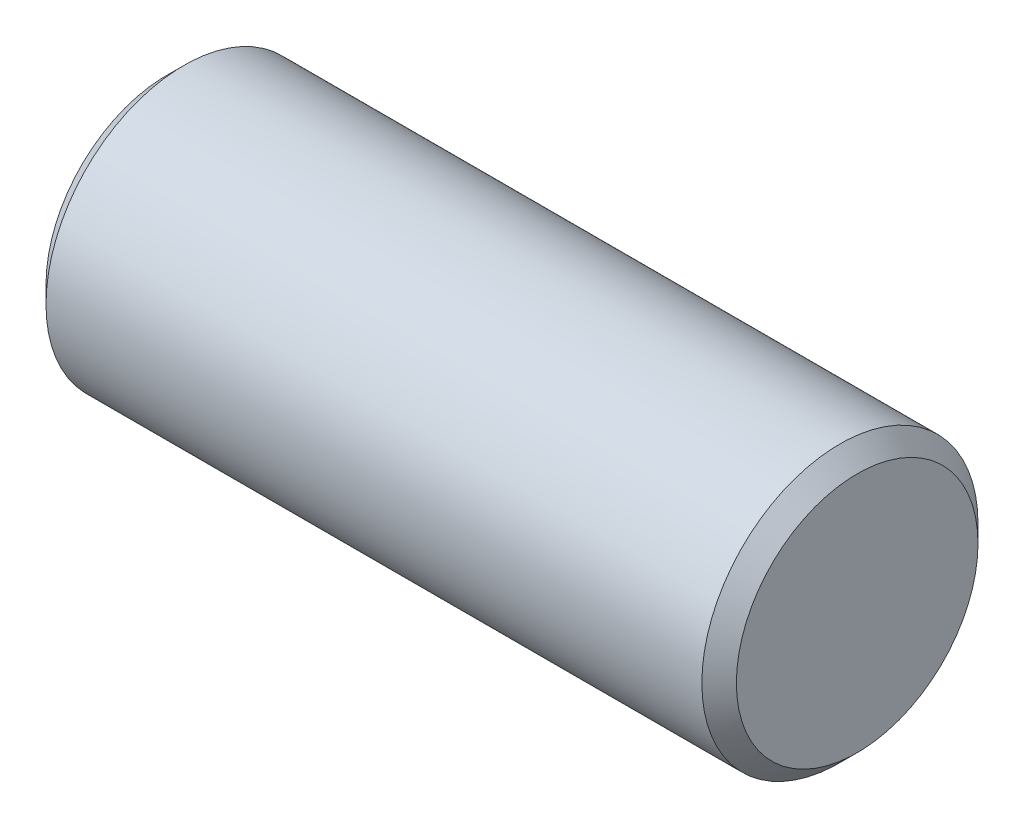
from build123d import *

# Parameters (mm, degrees)
SKETCH1_W     = 20
SKETCH1_H     = 4
CHAMFER1_SIZE = 0.5


with BuildPart() as part:
    # Sketch1 → Revolve1 (revolve)
    with BuildSketch(Plane.XY):
        with Locations((10, 2)):
            Rectangle(SKETCH1_W, SKETCH1_H)
    revolve(axis=Axis((0, 0, 0), (1, 0, 0)))

    # Chamfer1
    chamfer1_edges = [part.edges().sort_by_distance(p)[0] for p in [
        (20, -4, 0),
        (0, -4, 0),
    ]]
    chamfer(chamfer1_edges, length=CHAMFER1_SIZE)


solid = part.part
